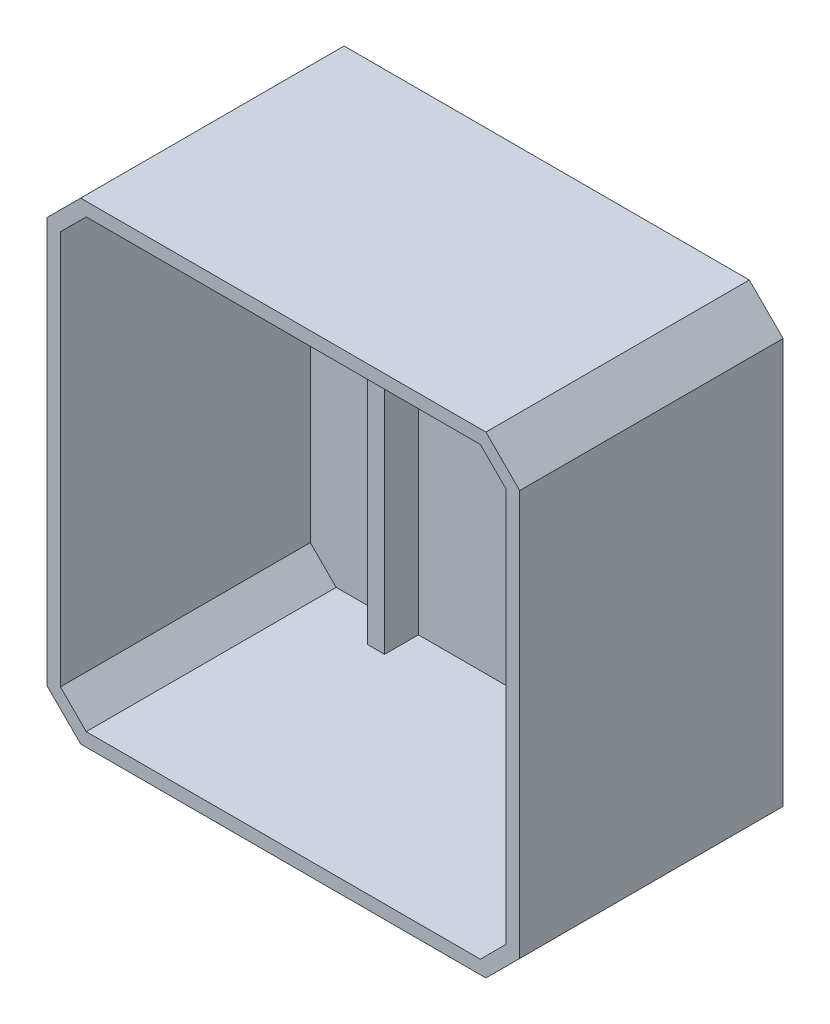
from build123d import *

# Parameters (mm, degrees)
SKETCH1_W           = 70
SKETCH1_H           = 70
BOSS_EXTRUDE1_DEPTH = 39
CHAMFER1_SIZE       = 5
SHELL1_T            = -2
SKETCH3_W           = 2.5
SKETCH3_H           = 66
BOSS_EXTRUDE2_DEPTH = 5


with BuildPart() as part:
    # Sketch1 → Boss-Extrude1 (new body)
    with BuildSketch(Plane.XY):
        with Locations((86.822194683, -0.073375262)):
            Rectangle(SKETCH1_W, SKETCH1_H)
    extrude(amount=-BOSS_EXTRUDE1_DEPTH)

    # Chamfer1
    chamfer1_edges = [part.edges().sort_by_distance(p)[0] for p in [
        (51.822194683, 34.926624738, -19.5),
        (121.822194683, 34.926624738, -19.5),
        (121.822194683, -35.073375262, -19.5),
        (51.822194683, -35.073375262, -19.5),
    ]]
    chamfer(chamfer1_edges, length=CHAMFER1_SIZE)

    # Shell1
    shell1_openings = [part.faces().sort_by_distance(p)[0] for p in [
        (86.822194683, -0.073375262, 0),
    ]]
    offset(amount=SHELL1_T, openings=shell1_openings, kind=Kind.INTERSECTION)

    # Sketch3 → Boss-Extrude2 (add)
    with BuildSketch(Plane.XY.offset(-37)):
        with Locations((68.572194683, -0.073375262)):
            Rectangle(SKETCH3_W, SKETCH3_H)
        with Locations((105.072194683, -0.073375262)):
            Rectangle(SKETCH3_W, SKETCH3_H)
    extrude(amount=BOSS_EXTRUDE2_DEPTH)


solid = part.part
